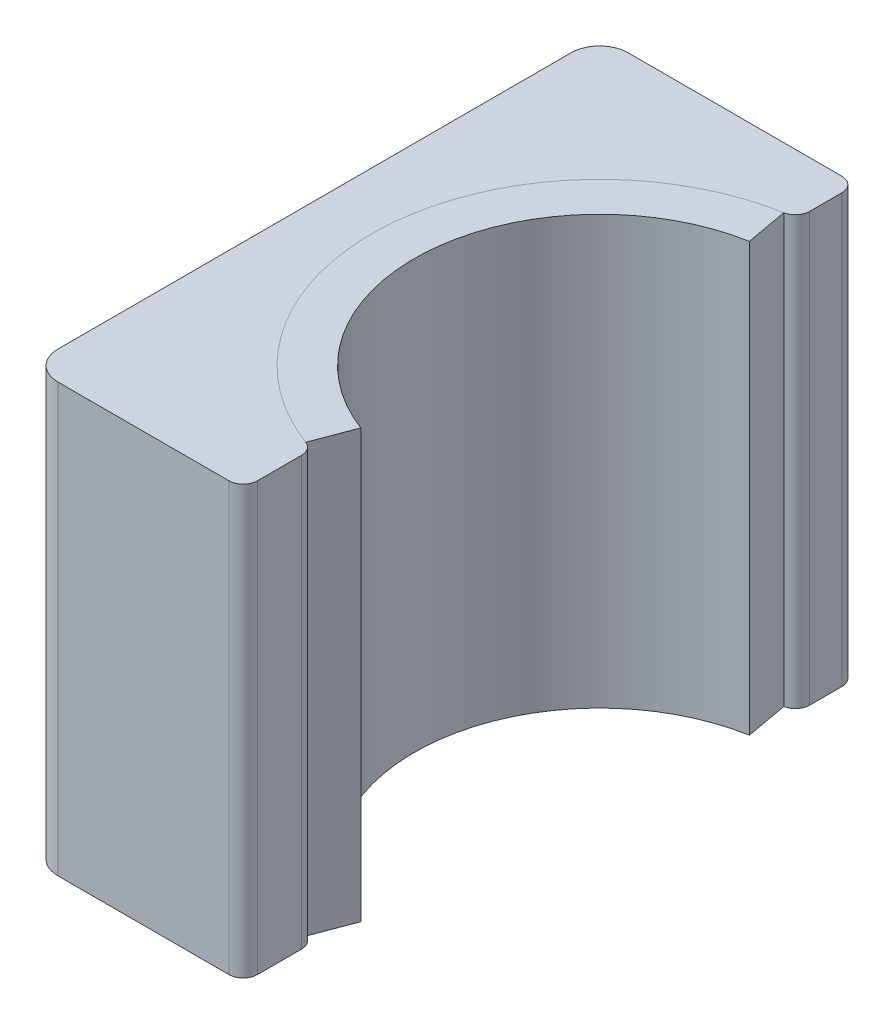
from build123d import *

# Parameters (mm, degrees)
EXTRUDE_1_DEPTH      = 15
EXTRUDE_1_DEPTH_BACK = 15
SKETCH_2_R           = 1.1
CUT_EXTRUDE_1_DEPTH  = 31.805843601
SKETCH_3_R           = 3
CUT_EXTRUDE_2_DEPTH  = 8
FILLET_1_R           = 2
EXTRUDE_2_DEPTH      = 30


with BuildPart() as part:
    # ｽｹｯﾁ1 → ﾎﾞｽ - 押し出し1 (new, two sides: drawn at the far end of the back side and taken through both)
    with BuildSketch(Plane(origin=(0, 0, 0), x_dir=(1, 0, 0), z_dir=(0, 1, 0)).offset(-EXTRUDE_1_DEPTH_BACK)):
        with BuildLine():
            Line((0, 20), (0, -20))
            Line((0, -20), (14, -20))
            ThreePointArc((14, -20), (14.707106781, -19.707106781), (15, -19))
            Line((15, -19), (15, -15.905973721))
            ThreePointArc((15, -15.905973721), (14.822478321, -15.337177262), (14.352941176, -14.970328208))
            ThreePointArc((14.352941176, -14.970328208), (4.06716036, 1.464452457), (17.176470588, 15.748894617))
            ThreePointArc((17.176470588, 15.748894617), (17.766964989, 16.091511583), (18, 16.733200531))
            Line((18, 16.733200531), (18, 19))
            ThreePointArc((18, 19), (17.707106781, 19.707106781), (17, 20))
            Line((17, 20), (0, 20))
        make_face()
    extrude(amount=EXTRUDE_1_DEPTH + EXTRUDE_1_DEPTH_BACK)

    # ｽｹｯﾁ2 → ｶｯﾄ - 押し出し1 (cut, through all)
    with BuildSketch(Plane(origin=(18, 0, 0), x_dir=(0, 0, -1), z_dir=(1, 0, 0))):
        with Locations((8, 10.5)):
            Circle(SKETCH_2_R)
        with Locations((8, -10.5)):
            Circle(SKETCH_2_R)
    extrude(amount=-CUT_EXTRUDE_1_DEPTH, mode=Mode.SUBTRACT)

    # ｽｹｯﾁ3 → ｶｯﾄ - 押し出し2 (cut)
    with BuildSketch(Plane.ZY.offset(-10)):
        with Locations(Location((-8, 10.5, 0), (0, 0, 180))):
            Circle(SKETCH_3_R)
        with Locations(Location((-8, -10.5, 0), (0, 0, 180))):
            Circle(SKETCH_3_R)
    extrude(amount=CUT_EXTRUDE_2_DEPTH, mode=Mode.SUBTRACT)

    # ﾌｨﾚｯﾄ1
    fillet_1_edges = [part.edges().sort_by_distance(p)[0] for p in [
        (0, 0, 20),
        (0, 0, -20),
    ]]
    fillet(fillet_1_edges, radius=FILLET_1_R)


with BuildPart() as body_2:
    # ｽｹｯﾁ5 → ﾎﾞｽ - 押し出し2 (new body)
    with BuildSketch(Plane(origin=(0, 15, 0), x_dir=(1, 0, 0), z_dir=(0, 1, 0))):
        with BuildLine():
            Line((17.176470588, 15.748894617), (17.705882353, 12.795976876))
            ThreePointArc((17.705882353, 12.795976876), (7.054567792, 1.189867621), (15.411764706, -12.163391669))
            Line((15.411764706, -12.163391669), (14.352941176, -14.970328208))
            ThreePointArc((14.352941176, -14.970328208), (4.06716036, 1.464452457), (17.176470588, 15.748894617))
        make_face()
    extrude(amount=-EXTRUDE_2_DEPTH)


solid = Compound([part.part, body_2.part])
